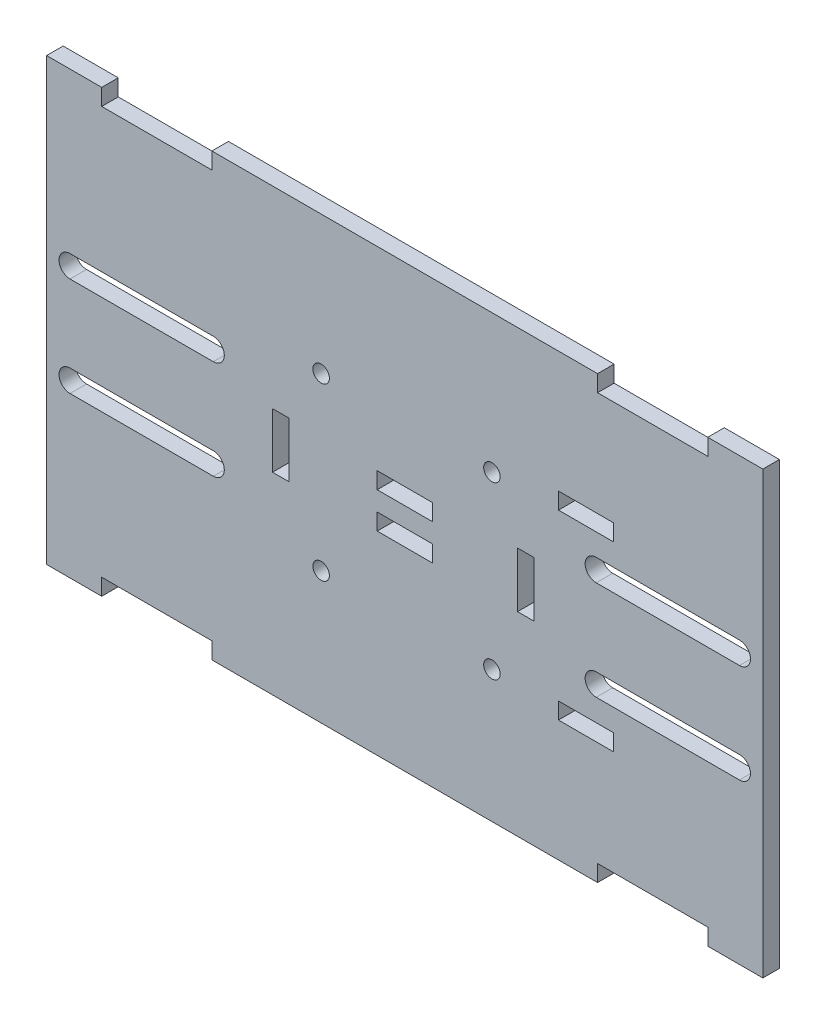
from build123d import *

# Parameters (mm, degrees)
SKETCH1_R           = 1.5
SKETCH1_W           = 3
SKETCH1_H           = 10
SKETCH1_W_2         = 10
SKETCH1_H_2         = 3
BOSS_EXTRUDE1_DEPTH = 3


with BuildPart() as part:
    # Sketch1 → Boss-Extrude1 (new body)
    with BuildSketch(Plane.XY):
        Polygon((-54.478363627, 39.675247502), (-54.478363627, 36.675247502), (-34.478363627, 36.675247502), (-34.478363627, 39.675247502), (35.521636373, 39.675247502), (35.521636373, 36.675247502), (55.521636373, 36.675247502), (55.521636373, 39.675247502), (65.521636373, 39.675247502), (65.521636373, -40.324752498), (55.521636373, -40.324752498), (55.521636373, -37.324752498), (35.521636373, -37.324752498), (35.521636373, -40.324752498), (-34.478363627, -40.324752498), (-34.478363627, -37.324752498), (-54.478363627, -37.324752498), (-54.478363627, -40.324752498), (-64.478363627, -40.324752498), (-64.478363627, 39.675247502), align=None)
        with Locations((16.34767445, 14.599209425)):
            Circle(SKETCH1_R, mode=Mode.SUBTRACT)
        with Locations((-14.65232555, 14.599209425)):
            Circle(SKETCH1_R, mode=Mode.SUBTRACT)
        with Locations((16.34767445, -16.400790575)):
            Circle(SKETCH1_R, mode=Mode.SUBTRACT)
        with Locations((-14.65232555, -16.400790575)):
            Circle(SKETCH1_R, mode=Mode.SUBTRACT)
        with Locations((22.5, 0)):
            Rectangle(SKETCH1_W, SKETCH1_H, mode=Mode.SUBTRACT)
        with Locations((-21.978363627, -0.324752498)):
            Rectangle(SKETCH1_W, SKETCH1_H, mode=Mode.SUBTRACT)
        with BuildLine():
            Line((-60.228363627, 10.675247502), (-34.228363627, 10.675247502))
            ThreePointArc((-34.228363627, 10.675247502), (-32.228363627, 8.675247502), (-34.228363627, 6.675247502))
            Line((-34.228363627, 6.675247502), (-60.228363627, 6.675247502))
            ThreePointArc((-60.228363627, 6.675247502), (-62.228363627, 8.675247502), (-60.228363627, 10.675247502))
        make_face(mode=Mode.SUBTRACT)
        with BuildLine():
            Line((-34.228363627, -7.324752498), (-60.228363627, -7.324752498))
            ThreePointArc((-60.228363627, -7.324752498), (-62.228363627, -9.324752498), (-60.228363627, -11.324752498))
            Line((-60.228363627, -11.324752498), (-34.228363627, -11.324752498))
            ThreePointArc((-34.228363627, -11.324752498), (-32.228363627, -9.324752498), (-34.228363627, -7.324752498))
        make_face(mode=Mode.SUBTRACT)
        with BuildLine():
            Line((35.271636373, 10.675247502), (61.271636373, 10.675247502))
            ThreePointArc((61.271636373, 10.675247502), (63.271636373, 8.675247502), (61.271636373, 6.675247502))
            Line((61.271636373, 6.675247502), (35.271636373, 6.675247502))
            ThreePointArc((35.271636373, 6.675247502), (33.271636373, 8.675247502), (35.271636373, 10.675247502))
        make_face(mode=Mode.SUBTRACT)
        with BuildLine():
            Line((35.271636373, -7.324752498), (61.271636373, -7.324752498))
            ThreePointArc((61.271636373, -7.324752498), (63.271636373, -9.324752498), (61.271636373, -11.324752498))
            Line((61.271636373, -11.324752498), (35.271636373, -11.324752498))
            ThreePointArc((35.271636373, -11.324752498), (33.271636373, -9.324752498), (35.271636373, -7.324752498))
        make_face(mode=Mode.SUBTRACT)
        with Locations((33.427979094, -16.824752498)):
            Rectangle(SKETCH1_W_2, SKETCH1_H_2, mode=Mode.SUBTRACT)
        with Locations((33.427979094, 16.175247502)):
            Rectangle(SKETCH1_W_2, SKETCH1_H_2, mode=Mode.SUBTRACT)
        with Locations((0.521636373, -3.574752498)):
            Rectangle(SKETCH1_W_2, SKETCH1_H_2, mode=Mode.SUBTRACT)
        with Locations((0.521636373, 2.925247502)):
            Rectangle(SKETCH1_W_2, SKETCH1_H_2, mode=Mode.SUBTRACT)
    extrude(amount=BOSS_EXTRUDE1_DEPTH)


solid = part.part
